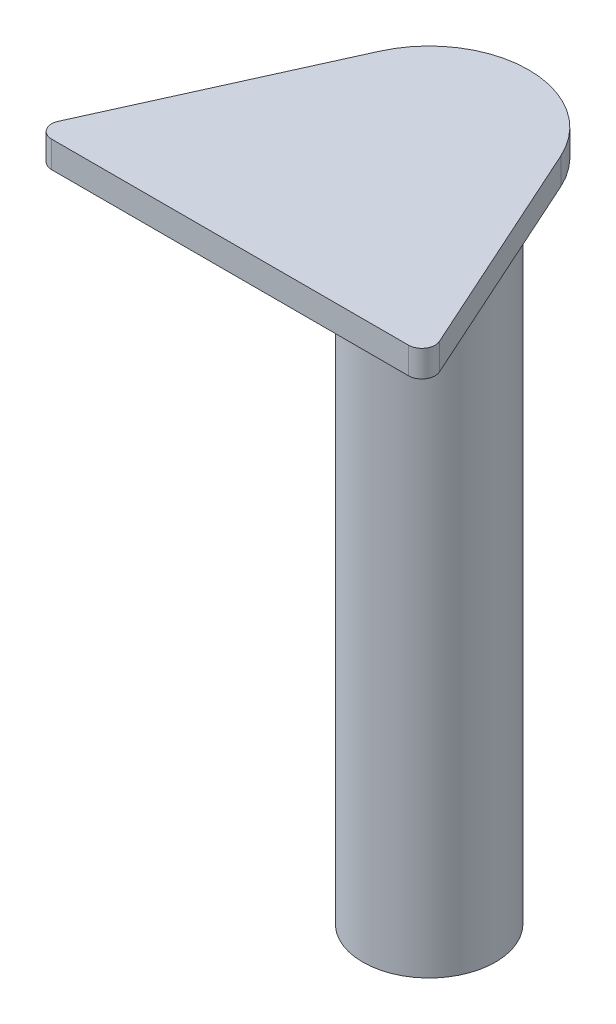
from build123d import *

# Parameters (mm, degrees)
SKETCH1_R           = 5
BOSS_EXTRUDE1_DEPTH = 50
BOSS_EXTRUDE2_DEPTH = 2


with BuildPart() as part:
    # Sketch1 → Boss-Extrude1 (new body)
    with BuildSketch(Plane(origin=(0, 0, 0), x_dir=(1, 0, 0), z_dir=(0, 1, 0))):
        with Locations(Location((0, 0, 0), (0, 0, 270))):
            Circle(SKETCH1_R)
    extrude(amount=BOSS_EXTRUDE1_DEPTH)

    # Sketch2 → Boss-Extrude2 (add)
    with BuildSketch(Plane(origin=(0, 50, 0), x_dir=(1, 0, 0), z_dir=(0, 1, 0))):
        with BuildLine():
            Line((-13.45141623, -15), (13.45141623, -15))
            ThreePointArc((13.45141623, -15), (14.291487009, -14.542476807), (14.362854057, -13.588562172))
            Line((14.362854057, -13.588562172), (6.835783708, 3.085783708))
            ThreePointArc((6.835783708, 3.085783708), (0, 7.5), (-6.835783708, 3.085783708))
            Line((-6.835783708, 3.085783708), (-14.362854057, -13.588562172))
            ThreePointArc((-14.362854057, -13.588562172), (-14.291487009, -14.542476807), (-13.45141623, -15))
        make_face()
    extrude(amount=BOSS_EXTRUDE2_DEPTH)


solid = part.part
